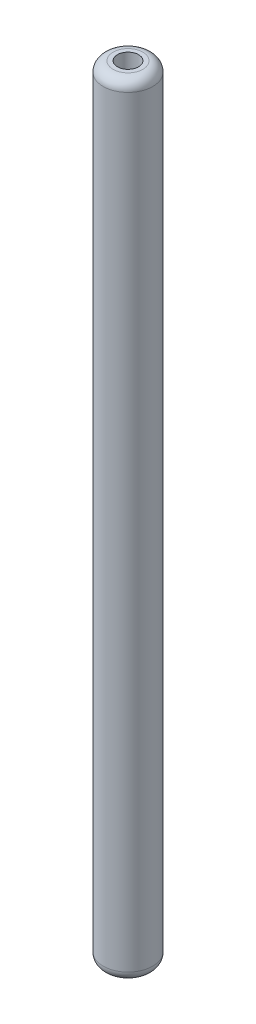
from build123d import *

# Parameters (mm, degrees)
SKETCH1_R                   = 6.35
BOSS_EXTRUDE1_DEPTH         = 200.025
F_1_4_28_TAPPED_HOLE6_D     = 5.4102
F_1_4_28_TAPPED_HOLE6_DEPTH = 29.972
F_1_4_28_TAPPED_HOLE6_TIP   = 1.625388061
F_1_4_28_TAPPED_HOLE8_D     = 5.4102
F_1_4_28_TAPPED_HOLE8_DEPTH = 29.972
F_1_4_28_TAPPED_HOLE8_TIP   = 1.625388061
FILLET4_R                   = 2.54
FILLET5_R                   = 2.54


with BuildPart() as part:
    # Sketch1 → Boss-Extrude1 (new body)
    with BuildSketch(Plane(origin=(0, 0, 0), x_dir=(1, 0, 0), z_dir=(0, 1, 0))):
        with Locations(Location((0, 0, 0), (0, 0, 90))):
            Circle(SKETCH1_R)
    extrude(amount=BOSS_EXTRUDE1_DEPTH)

    # 1/4-28 Tapped Hole6
    with Locations(Plane.ZX.offset(200.025)):
        with Locations((0, 0)):
            Hole(F_1_4_28_TAPPED_HOLE6_D / 2, depth=F_1_4_28_TAPPED_HOLE6_DEPTH)
            with Locations((0, 0, -(F_1_4_28_TAPPED_HOLE6_DEPTH + F_1_4_28_TAPPED_HOLE6_TIP / 2))):  # 118° drill point
                Cone(0, F_1_4_28_TAPPED_HOLE6_D / 2, F_1_4_28_TAPPED_HOLE6_TIP, mode=Mode.SUBTRACT)

    # 1/4-28 Tapped Hole8
    with Locations(Plane(origin=(0, 0, 0), x_dir=(0, 0, -1), z_dir=(0, -1, 0))):
        with Locations((0, 0)):
            Hole(F_1_4_28_TAPPED_HOLE8_D / 2, depth=F_1_4_28_TAPPED_HOLE8_DEPTH)
            with Locations((0, 0, -(F_1_4_28_TAPPED_HOLE8_DEPTH + F_1_4_28_TAPPED_HOLE8_TIP / 2))):  # 118° drill point
                Cone(0, F_1_4_28_TAPPED_HOLE8_D / 2, F_1_4_28_TAPPED_HOLE8_TIP, mode=Mode.SUBTRACT)

    # Fillet4
    fillet4_edges = [part.edges().sort_by_distance(p)[0] for p in [
        (0, 200.025, 6.35),
    ]]
    fillet(fillet4_edges, radius=FILLET4_R)

    # Fillet5
    fillet5_edges = [part.edges().sort_by_distance(p)[0] for p in [
        (0, 0, 6.35),
    ]]
    fillet(fillet5_edges, radius=FILLET5_R)


solid = part.part
